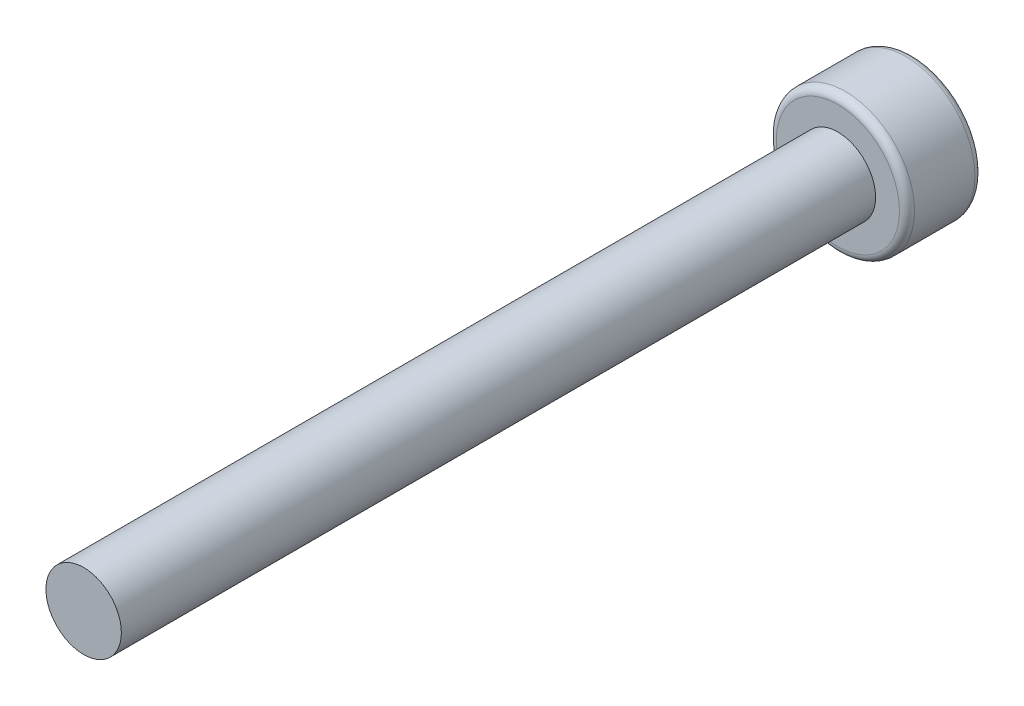
from build123d import *

# Parameters (mm, degrees)
SKETCH_1_R          = 2.75
EXTRUDE_1_DEPTH     = 3
SKETCH_2_R          = 1.5
EXTRUDE_2_DEPTH     = 30
FILLET_1_R          = 0.3
CUT_EXTRUDE_1_DEPTH = 2


with BuildPart() as part:
    # 草图1 → 凸台-拉伸1 (new body)
    with BuildSketch(Plane.XY):
        Circle(SKETCH_1_R)
    extrude(amount=EXTRUDE_1_DEPTH)

    # 草图2 → 凸台-拉伸2 (add)
    with BuildSketch(Plane.XY.offset(3)):
        Circle(SKETCH_2_R)
    extrude(amount=EXTRUDE_2_DEPTH)

    # 圆角1
    fillet_1_edges = [part.edges().sort_by_distance(p)[0] for p in [
        (-2.75, 0, 0),
        (-2.75, 0, 3),
    ]]
    fillet(fillet_1_edges, radius=FILLET_1_R)

    # 草图3 → 切除-拉伸1 (cut)
    with BuildSketch(Plane(origin=(0, 0, 0), x_dir=(-1, 0, 0), z_dir=(0, 0, -1))):
        Polygon((-0.820853493, 1.862408161), (-2.023319526, 0.220324103), (-1.202466033, -1.642084058), (0.820853493, -1.862408161), (2.023319526, -0.220324103), (1.202466033, 1.642084058), align=None)
    extrude(amount=-CUT_EXTRUDE_1_DEPTH, mode=Mode.SUBTRACT)


solid = part.part
